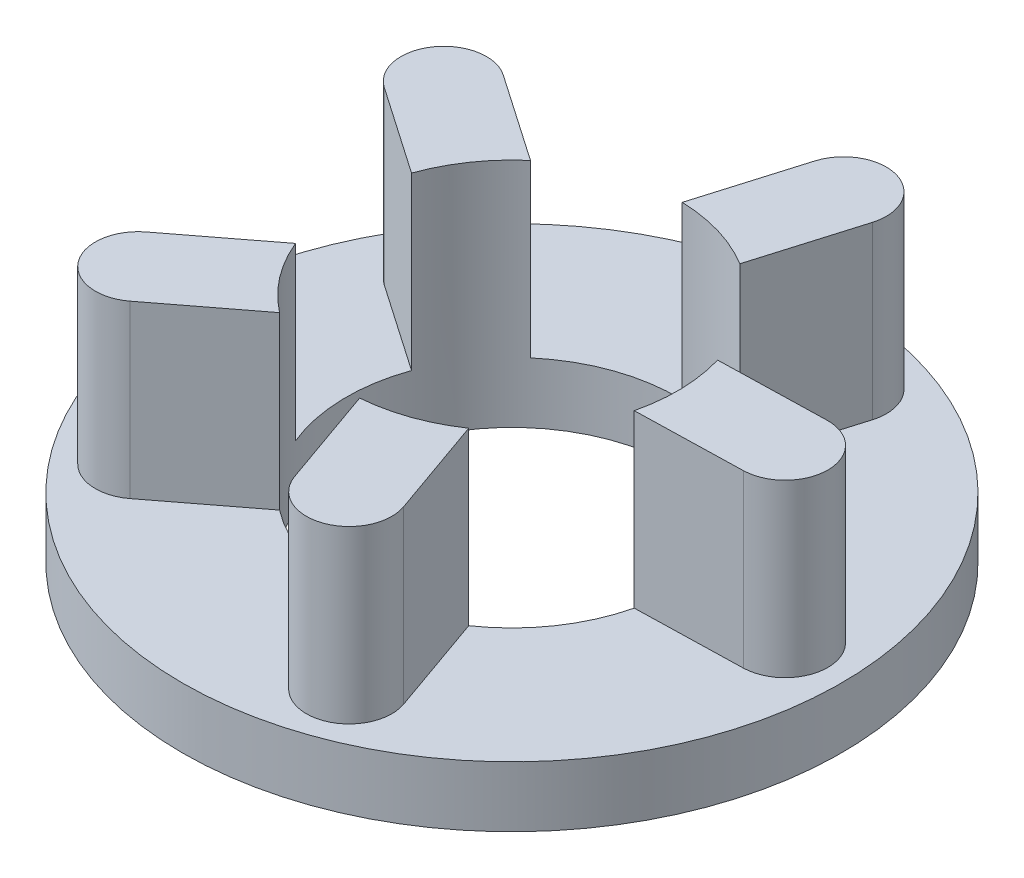
from build123d import *
from build123d.topology import SkipClean

# Parameters (mm, degrees)
BOSS_EXTRUDE1_DEPTH   = 4.8
BOSS_EXTRUDE1_2_DEPTH = 4.8
BOSS_EXTRUDE1_3_DEPTH = 4.8
BOSS_EXTRUDE1_4_DEPTH = 4.8
BOSS_EXTRUDE1_5_DEPTH = 4.8
BOSS_EXTRUDE2_START   = -1.7
SKETCH1_3_R           = 9.25
SKETCH1_3_R_2         = 4.65
BOSS_EXTRUDE2_DEPTH   = 1.7


with BuildPart() as part:
    # Sketch1 → Boss-Extrude1 (new body)
    with BuildSketch(Plane(origin=(0, 0, 0), x_dir=(1, 0, 0), z_dir=(0, 1, 0))):
        with BuildLine():
            ThreePointArc((-5.480218714, 5.235321016), (-7.1492914, 4.928406745), (-6.842377129, 3.259334059))
            Line((-6.842377129, 3.259334059), (-4.379874637, 1.561793252))
            ThreePointArc((-4.379874637, 1.561793252), (-3.828474728, 2.63918193), (-3.017716222, 3.537780209))
            Line((-3.017716222, 3.537780209), (-5.480218714, 5.235321016))
        make_face()
    extrude(amount=BOSS_EXTRUDE1_DEPTH)



with BuildPart() as body_2:
    # Sketch1 → Boss-Extrude1 2 (new body)
    with BuildSketch(Plane(origin=(0, 0, 0), x_dir=(1, 0, 0), z_dir=(0, 1, 0))):
        with BuildLine():
            ThreePointArc((-2.838809346, -3.682887658), (-3.693074925, -2.82554377), (-4.297154517, -1.77678447))
            Line((-4.297154517, -1.77678447), (-6.672566882, -3.594194554))
            ThreePointArc((-6.672566882, -3.594194554), (-6.89644589, -5.276418733), (-5.214221711, -5.500297741))
            Line((-5.214221711, -5.500297741), (-2.838809346, -3.682887658))
        make_face()
    extrude(amount=BOSS_EXTRUDE1_2_DEPTH)


with BuildPart() as body_3:
    # Sketch1 → Boss-Extrude1 3 (new body)
    with BuildSketch(Plane(origin=(0, 0, 0), x_dir=(1, 0, 0), z_dir=(0, 1, 0))):
        with BuildLine():
            Line((0.985400081, 7.51467697), (0.131897954, 4.648128971))
            ThreePointArc((0.131897954, 4.648128971), (1.326947418, 4.456647905), (2.432103324, 3.963252884))
            Line((2.432103324, 3.963252884), (3.285605451, 6.829800884))
            ThreePointArc((3.285605451, 6.829800884), (2.47794081, 8.322341612), (0.985400081, 7.51467697))
        make_face()
    extrude(amount=BOSS_EXTRUDE1_3_DEPTH)


with BuildPart() as body_4:
    # Sketch1 → Boss-Extrude1 4 (new body)
    with BuildSketch(Plane(origin=(0, 0, 0), x_dir=(1, 0, 0), z_dir=(0, 1, 0))):
        with BuildLine():
            ThreePointArc((2.625393974, -3.837943001), (1.546028901, -4.385464016), (0.361928675, -4.635893402))
            Line((0.361928675, -4.635893402), (1.356345588, -7.456655412))
            ThreePointArc((1.356345588, -7.456655412), (2.887053438, -8.189412861), (3.619810887, -6.658705012))
            Line((3.619810887, -6.658705012), (2.625393974, -3.837943001))
        make_face()
    extrude(amount=BOSS_EXTRUDE1_4_DEPTH)


with BuildPart() as body_5:
    # Sketch1 → Boss-Extrude1 5 (new body)
    with BuildSketch(Plane(origin=(0, 0, 0), x_dir=(1, 0, 0), z_dir=(0, 1, 0))):
        with BuildLine():
            Line((7.451387872, 1.384991723), (4.461392056, 1.310908436))
            ThreePointArc((4.461392056, 1.310908436), (4.648573334, 0.115177951), (4.52083874, -1.08835522))
            Line((4.52083874, -1.08835522), (7.510834557, -1.014271933))
            ThreePointArc((7.510834557, -1.014271933), (8.680743042, 0.215083237), (7.451387872, 1.384991723))
        make_face()
    extrude(amount=BOSS_EXTRUDE1_5_DEPTH)


with BuildPart() as part_1:
    with SkipClean():  # the faces are left unmerged after this step: merging them gives an invalid solid
        add(part.part)

        add(body_2.part)  # Boss-Extrude2 merges body 2

        add(body_3.part)  # Boss-Extrude2 merges body 3

        add(body_4.part)  # Boss-Extrude2 merges body 4

        add(body_5.part)  # Boss-Extrude2 merges body 5
        # Sketch1<3> → Boss-Extrude2 (add)
        with BuildSketch(Plane(origin=(0, 0, 0), x_dir=(1, 0, 0), z_dir=(0, 1, 0)).offset(BOSS_EXTRUDE2_START)):
            Circle(SKETCH1_3_R)
            Circle(SKETCH1_3_R_2, mode=Mode.SUBTRACT)
        extrude(amount=BOSS_EXTRUDE2_DEPTH)


solid = part_1.part
